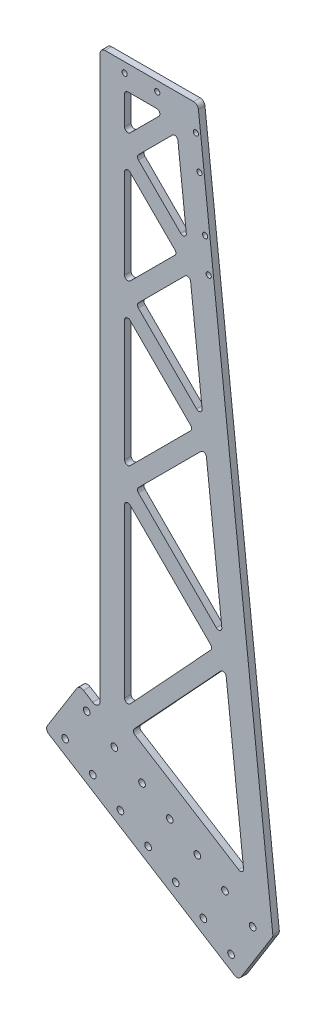
from build123d import *

# Parameters (mm, degrees)
EXTRUDE_1_DEPTH     = 4
SKETCH_2_R          = 2.05
CUT_EXTRUDE_1_DEPTH = 1051.370094301
FILLET_2_R          = 3
CUT_EXTRUDE_2_DEPTH = 1051.360446107
FILLET_3_R          = 2
SKETCH_4_R          = 1.6
CUT_EXTRUDE_3_DEPTH = 1051.360446107
SKETCH_5_R          = 1.6
CUT_EXTRUDE_4_DEPTH = 1051.360446107


with BuildPart() as part:
    # 草图1 → 凸台-拉伸1 (new body)
    with BuildSketch(Plane.XY):
        Polygon((-33.921923846, 666.196770569), (0, 645), (0, 692.167136134), (-12.725153277, 700.118694416), align=None)
        Polygon((21.196770569, 678.921923846), (0, 645), (84.804809616, 592.008073577), (106.001580185, 625.929997423), align=None)
        Polygon((0, 692.167136134), (0, 645), (21.196770569, 678.921923846), align=None)
        Polygon((0, 1045), (0, 692.167136134), (21.196770569, 678.921923846), (106.001580185, 625.929997423), (60, 1045), align=None)
    extrude(amount=EXTRUDE_1_DEPTH)

    # 草图2 → 切除-拉伸1 (cut, through all)
    with BuildSketch(Plane.XY.offset(4)):
        with Locations((-8.219066797, 688.459141052)):
            Circle(SKETCH_2_R)
        with Locations((-21.467048403, 667.257938648)):
            Circle(SKETCH_2_R)
        with Locations((-4.50608648, 656.659553364)):
            Circle(SKETCH_2_R)
        with Locations((8.741895126, 677.860755767)):
            Circle(SKETCH_2_R)
        with Locations((12.454875443, 646.061168079)):
            Circle(SKETCH_2_R)
        with Locations((25.702857049, 667.262370483)):
            Circle(SKETCH_2_R)
        with Locations((29.415837366, 635.462782794)):
            Circle(SKETCH_2_R)
        with Locations((42.663818972, 656.663985198)):
            Circle(SKETCH_2_R)
        with Locations((46.37679929, 624.86439751)):
            Circle(SKETCH_2_R)
        with Locations((59.624780895, 646.065599913)):
            Circle(SKETCH_2_R)
        with Locations((63.337761213, 614.266012225)):
            Circle(SKETCH_2_R)
        with Locations((76.585742819, 635.467214629)):
            Circle(SKETCH_2_R)
        with Locations((80.298723136, 603.66762694)):
            Circle(SKETCH_2_R)
        with Locations((93.546704742, 624.868829344)):
            Circle(SKETCH_2_R)
    extrude(amount=-CUT_EXTRUDE_1_DEPTH, mode=Mode.SUBTRACT)

    # 圆角2
    fillet_2_edges = [part.edges().sort_by_distance(p)[0] for p in [
        (0, 1045, 2),
        (60, 1045, 2),
        (106.001580185, 625.929997423, 2),
        (84.804809616, 592.008073577, 2),
        (-33.921923846, 666.196770569, 2),
        (-12.725153277, 700.118694416, 2),
        (0, 692.167136134, 2),
    ]]
    fillet(fillet_2_edges, radius=FILLET_2_R)

    # 草图3 → 切除-拉伸2 (cut, through all)
    with BuildSketch(Plane(origin=(0, 0, 0), x_dir=(-1, 0, 0), z_dir=(0, 0, -1))):
        Polygon((-15, 1005.514609624), (-15, 1030), (-39.485390376, 1030), align=None)
        Polygon((-22.071067812, 998.443541812), (-47.25587803, 1023.62835203), (-53.466755162, 967.047854463), align=None)
        Polygon((-15, 926.837288925), (-15, 991.372474001), (-47.267592538, 959.104881463), align=None)
        Polygon((-22.071067812, 919.766221113), (-55.038080192, 952.733233493), (-63.168141984, 878.669146941), align=None)
        Polygon((-15, 828.75719458), (-15, 912.695153301), (-56.96897936, 870.726173941), align=None)
        Polygon((-22.071067812, 821.686126769), (-64.739467014, 864.354525971), (-75.262007489, 768.495187091), align=None)
        Polygon((-15, 701.941730178), (-15, 814.615058957), (-69.194713321, 760.420345636), align=None)
        Polygon((-19.317026748, 691.888302183), (-76.855856505, 753.975374761), (-88.41047261, 648.713925446), align=None)
    extrude(amount=-CUT_EXTRUDE_2_DEPTH, mode=Mode.SUBTRACT)

    # 圆角3
    fillet_3_edges = [part.edges().sort_by_distance(p)[0] for p in [
        (22.071067812, 919.766221113, 2),
        (63.168141984, 878.669146941, 2),
        (55.038080192, 952.733233493, 2),
        (56.96897936, 870.726173941, 2),
        (15, 912.695153301, 2),
        (15, 828.75719458, 2),
        (22.071067812, 998.443541812, 2),
        (53.466755162, 967.047854463, 2),
        (47.25587803, 1023.62835203, 2),
        (47.267592538, 959.104881463, 2),
        (15, 991.372474001, 2),
        (15, 926.837288925, 2),
        (76.855856505, 753.975374761, 2),
        (19.317026748, 691.888302183, 2),
        (88.41047261, 648.713925446, 2),
        (22.071067812, 821.686126769, 2),
        (75.262007489, 768.495187091, 2),
        (64.739467014, 864.354525971, 2),
        (69.194713321, 760.420345636, 2),
        (15, 814.615058957, 2),
        (15, 701.941730178, 2),
        (39.485390376, 1030, 2),
        (15, 1030, 2),
        (15, 1005.514609624, 2),
    ]]
    fillet(fillet_3_edges, radius=FILLET_3_R)

    # 草图4 → 切除-拉伸3 (cut, through all)
    with BuildSketch(Plane(origin=(0, 0, 0), x_dir=(-1, 0, 0), z_dir=(0, 0, -1))):
        with Locations((-35, 1039)):
            Circle(SKETCH_4_R)
        with Locations((-15, 1039)):
            Circle(SKETCH_4_R)
    extrude(amount=-CUT_EXTRUDE_3_DEPTH, mode=Mode.SUBTRACT)

    # 草图5 → 切除-拉伸4 (cut, through all)
    with BuildSketch(Plane(origin=(0, 0, 0), x_dir=(-1, 0, 0), z_dir=(0, 0, -1))):
        with Locations((-60.912093448, 1009.197039366)):
            Circle(SKETCH_5_R)
        with Locations((-58.72978932, 1029.077621569)):
            Circle(SKETCH_5_R)
        with Locations((-64.403780052, 977.388107843)):
            Circle(SKETCH_5_R)
        with Locations((-66.586084179, 957.507525641)):
            Circle(SKETCH_5_R)
    extrude(amount=-CUT_EXTRUDE_4_DEPTH, mode=Mode.SUBTRACT)


solid = part.part
